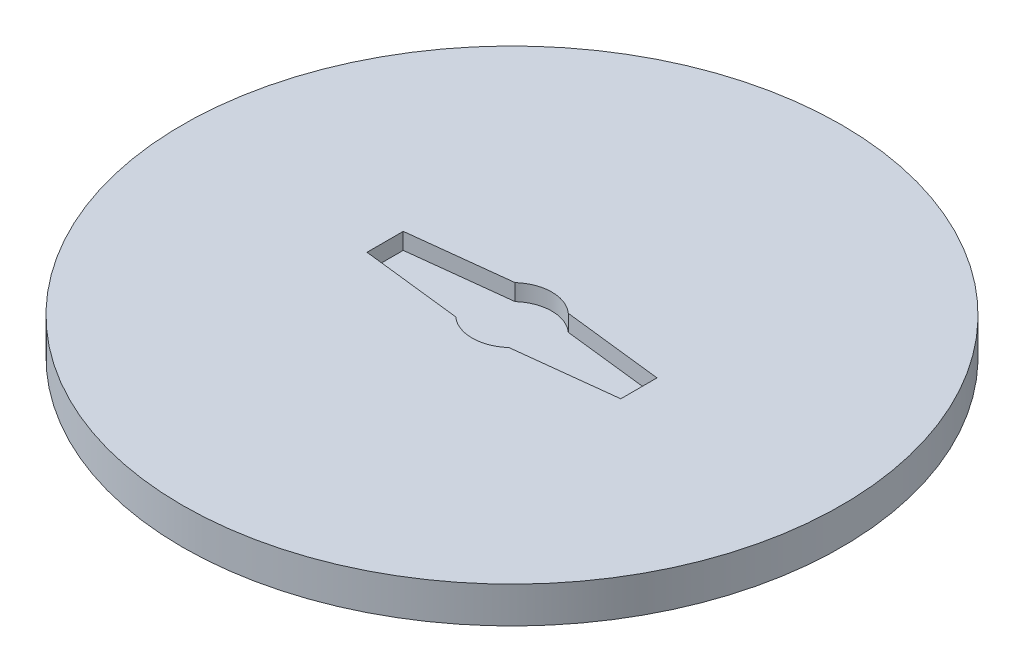
from build123d import *

# Parameters (mm, degrees)
SKETCH1_R           = 50
BOSS_EXTRUDE1_DEPTH = 5.5
CUT_EXTRUDE1_DEPTH  = 2.5


with BuildPart() as part:
    # Sketch1 → Boss-Extrude1 (new body)
    with BuildSketch(Plane(origin=(0, 0, 0), x_dir=(1, 0, 0), z_dir=(0, 1, 0))):
        with Locations(Location((0, 0, 0), (0, 0, 270))):
            Circle(SKETCH1_R)
    extrude(amount=BOSS_EXTRUDE1_DEPTH)

    # Sketch2 → Cut-Extrude1 (cut)
    with BuildSketch(Plane(origin=(0, 5.5, 0), x_dir=(1, 0, 0), z_dir=(0, 1, 0))):
        with BuildLine():
            Line((-4.043822449, -4.5), (-19.25, -2.75))
            Line((-19.25, -2.75), (-19.25, 2.75))
            Line((-19.25, 2.75), (-4.043822449, 4.5))
            ThreePointArc((-4.043822449, 4.5), (0, 6.05), (4.043822449, 4.5))
            Line((4.043822449, 4.5), (19.25, 2.75))
            Line((19.25, 2.75), (19.25, -2.75))
            Line((19.25, -2.75), (4.043822449, -4.5))
            ThreePointArc((4.043822449, -4.5), (0, -6.05), (-4.043822449, -4.5))
        make_face()
    extrude(amount=-CUT_EXTRUDE1_DEPTH, mode=Mode.SUBTRACT)


solid = part.part
